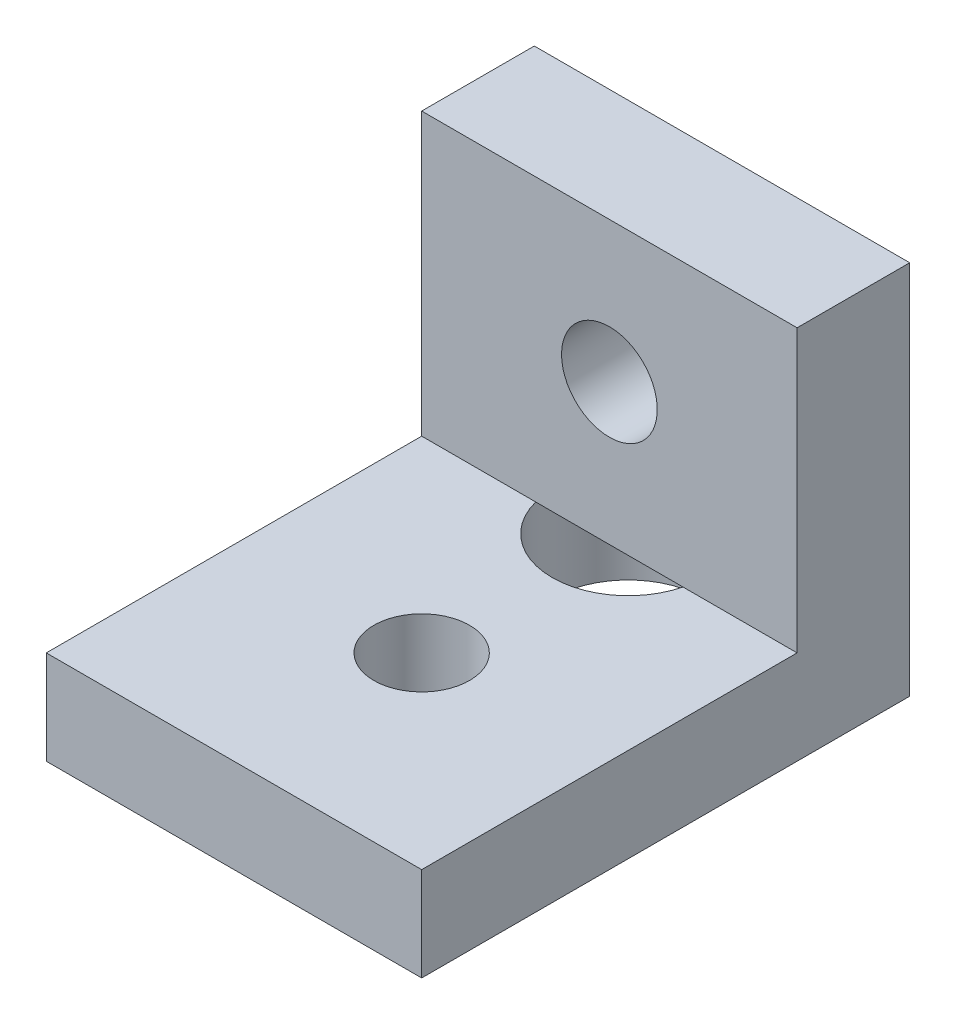
from build123d import *

# Parameters (mm, degrees)
SKETCH1_R           = 2.55
BOSS_EXTRUDE1_DEPTH = 5
BOSS_EXTRUDE2_DEPTH = 20
BOSS_EXTRUDE3_DEPTH = 15
CUT_EXTRUDE1_DEPTH  = 39.418745425


with BuildPart() as part:
    # Sketch1 → Boss-Extrude1 (new body)
    # profile 1 of 2: a face of its own
    with BuildSketch(Plane(origin=(0, 0, 0), x_dir=(1, 0, 0), z_dir=(0, 1, 0))):
        with BuildLine():
            Line((6.075398109, 20), (0, 20))
            Line((0, 20), (0, 0))
            Line((0, 0), (20, 0))
            Line((20, 0), (20, 20))
            Line((20, 20), (13.924601891, 20))
            ThreePointArc((13.924601891, 20), (10, 16.95), (6.075398109, 20))
        make_face()
        with Locations(Location((10, 10, 0), (0, 0, 270))):
            Circle(SKETCH1_R, mode=Mode.SUBTRACT)
    # profile 2 of 2: a face of its own
    with BuildSketch(Plane(origin=(0, 0, 0), x_dir=(1, 0, 0), z_dir=(0, 1, 0))):
        with BuildLine():
            Line((0, 26), (0, 20))
            Line((0, 20), (6.075398109, 20))
            ThreePointArc((6.075398109, 20), (9.496084162, 25.018528192), (14.05, 21))
            ThreePointArc((14.05, 21), (14.018528192, 20.496084162), (13.924601891, 20))
            Line((13.924601891, 20), (20, 20))
            Line((20, 20), (20, 26))
            Line((20, 26), (0, 26))
        make_face()
    extrude(amount=BOSS_EXTRUDE1_DEPTH)

    # Sketch1<3> → Boss-Extrude2 (add)
    with BuildSketch(Plane(origin=(0, 0, 0), x_dir=(1, 0, 0), z_dir=(0, 1, 0))):
        with BuildLine():
            Line((0, 26), (0, 20))
            Line((0, 20), (6.075398109, 20))
            ThreePointArc((6.075398109, 20), (9.496084162, 25.018528192), (14.05, 21))
            ThreePointArc((14.05, 21), (14.018528192, 20.496084162), (13.924601891, 20))
            Line((13.924601891, 20), (20, 20))
            Line((20, 20), (20, 26))
            Line((20, 26), (0, 26))
        make_face()
    extrude(amount=BOSS_EXTRUDE2_DEPTH)

    # Sketch3 → Boss-Extrude3 (add)
    with BuildSketch(Plane(origin=(0, 5, 0), x_dir=(1, 0, 0), z_dir=(0, 1, 0))):
        with BuildLine():
            Line((13.924601891, 20), (6.075398109, 20))
            ThreePointArc((6.075398109, 20), (10, 25.05), (13.924601891, 20))
        make_face()
    extrude(amount=BOSS_EXTRUDE3_DEPTH)

    # Sketch2 → Cut-Extrude1 (cut, through all)
    with BuildSketch(Plane(origin=(0, 0, -26), x_dir=(-1, 0, 0), z_dir=(0, 0, -1))):
        with BuildLine():
            ThreePointArc((-12.55, 12.5), (-10, 9.95), (-7.45, 12.5))
            Line((-7.45, 12.5), (-12.55, 12.5))
        make_face()
        with BuildLine():
            Line((-12.55, 12.5), (-7.45, 12.5))
            ThreePointArc((-7.45, 12.5), (-10, 15.05), (-12.55, 12.5))
        make_face()
    extrude(amount=-CUT_EXTRUDE1_DEPTH, mode=Mode.SUBTRACT)


solid = part.part
